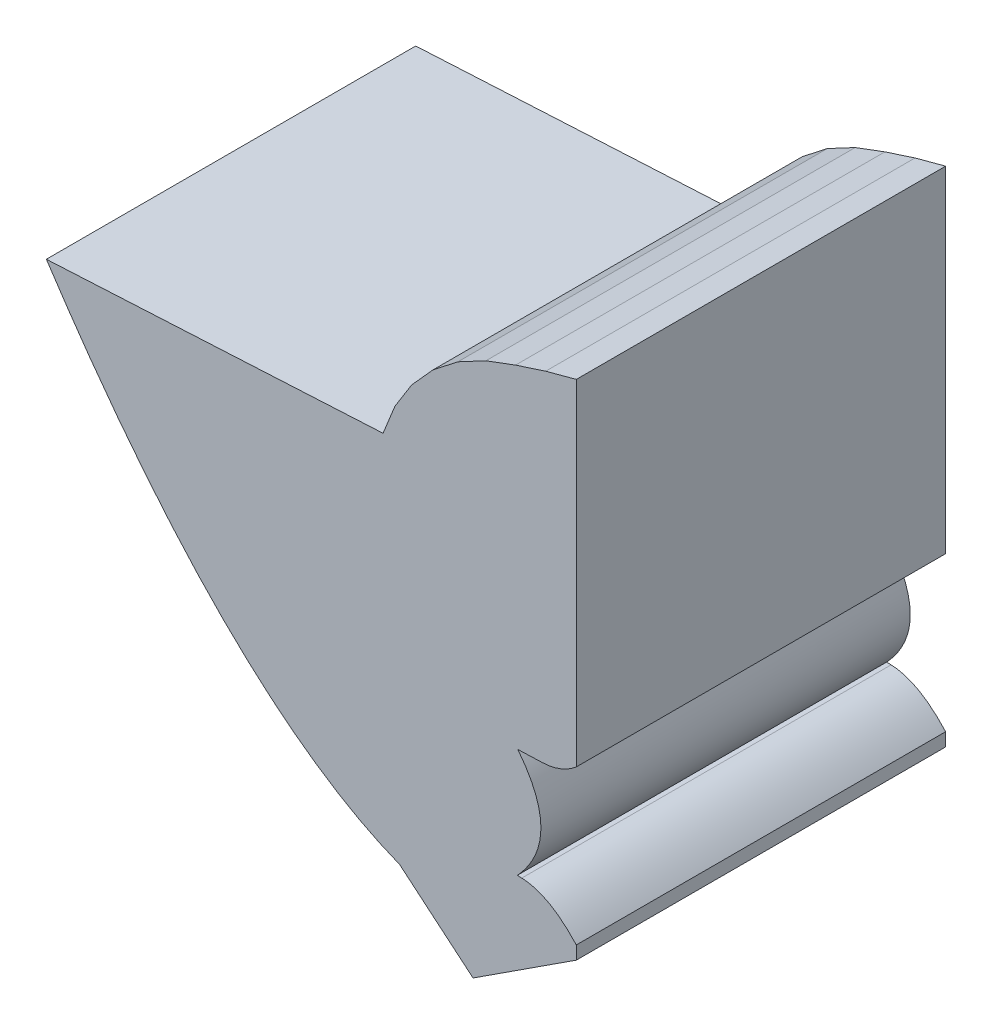
from build123d import *

# Parameters (mm, degrees)
CROQUIS_BASE_DEPTH              = 6.9937
LENTE_PPAL_1_REACH              = 29.176
LENTE_PPAL_1_DIRECTION_2_REACH  = 29.176
LENTE_PPAL_2_DEPTH              = 28.175928622
LENTE_PPAL_2_DEPTH_BACK         = 28.175928622
CROQUIS9_3_OUTSIDE_W            = 30.065
CROQUIS9_3_OUTSIDE_H            = 25.937
LENTE_FRONTAL_REACH             = 25.403
LENTE_FRONTAL_DIRECTION_2_REACH = 25.403
LENTE_TRASERA_REACH             = 28.281
LENTE_TRASERA_DIRECTION_2_REACH = 28.281


with BuildPart() as part:
    # Croquis1 → croquis base (new, symmetric)
    with BuildSketch(Plane.XY):
        with BuildLine():
            Line((-6.994875026, 10.477389992), (-8.981845695, 12.608155172))
            Line((-8.981845695, 12.608155172), (-23.035921146, 11.871612288))
            Line((-23.035921146, 11.871612288), (-23.035921146, 11.54013782))
            ThreePointArc((-23.035921146, 11.54013782), (-20.949684518, 9.582335705), (-18.945192114, 7.540918896))
            add(Edge.make_bspline(
                [(-18.945192114, 7.540918896), (-10.215008384, -3.697644103), (-2.846604825, -5.059081104)],
                knots=[0.497667241, 0.497667241, 0.497667241, 0.49955428, 0.49955428, 0.49955428], degree=2))
            add(Edge.make_bspline(
                [(-2.846604825, -5.059081104), (-2.498165198, -4.87297933), (-2.177330417, -4.684462446)],
                knots=[0.498812075, 0.498812075, 0.498812075, 0.498911556, 0.498911556, 0.498911556], degree=2))
            Line((-2.177330418, -4.684462446), (-2.177330418, 6.186438919))
            add(Edge.make_bspline(
                [(-2.177330418, 6.186438919), (-4.063319702, 8.141636997), (-6.994875026, 10.477389992)],
                knots=[0.50138293, 0.50138293, 0.50138293, 0.502013312, 0.502013312, 0.502013312], degree=2))
        make_face()
    extrude(amount=CROQUIS_BASE_DEPTH, both=True)

    # lente ppal 1: up to this face of the body (flat: up to its plane)
    lente_ppal_1_end = Plane(part.part.faces().sort_by_distance((-10.153546236, 5.159655324, 6.9937))[0])
    # Croquis9 → lente ppal 1 (add, up to the picked face)
    with BuildSketch(Plane.XY, mode=Mode.PRIVATE) as lente_ppal_1_sk1:
        with BuildLine():
            Line((-2.177330418, -4.388282022), (-2.177330418, -1.840420572))
            add(Edge.make_bspline(
                [(-2.177330418, 2.424232079), (-0.304369248, 0.128042884), (-2.177330418, -1.840420572)],
                knots=[0, 0, 0, 1, 1, 1], degree=2))
            Line((-2.177330418, 2.424232079), (-2.177330418, 6.082860828))
            Line((-2.177330418, 6.082860828), (-10.309820395, 10))
            Line((-10.309820395, 10), (-19.969359014, 9.493765032))
            add(Edge.make_bspline(
                [(-2.177330418, -4.388282022), (-10.4130765, -4.994158739), (-19.969359014, 9.493765032)],
                knots=[0, 0, 0, 1, 1, 1], degree=2))
        make_face()
    lente_ppal_1_tool1 = split(extrude(lente_ppal_1_sk1.sketch, amount=LENTE_PPAL_1_REACH, mode=Mode.PRIVATE), bisect_by=lente_ppal_1_end, keep=Keep.BOTH, mode=Mode.PRIVATE)
    add(lente_ppal_1_tool1.solids().sort_by(Axis((-9.106368, 3.599172, 0), (0, 0, 1)))[0])

    # lente ppal 1 direction 2: up to this face of the body (flat: up to its plane)
    lente_ppal_1_direction_2_end = Plane(part.part.faces().sort_by_distance((-10.153546236, 5.159655324, -6.9937))[0])
    # Croquis9 → lente ppal 1 direction 2 (add, up to the picked face)
    with BuildSketch(Plane.XY, mode=Mode.PRIVATE) as lente_ppal_1_direction_2_sk1:
        with BuildLine():
            Line((-2.177330418, -4.388282022), (-2.177330418, -1.840420572))
            add(Edge.make_bspline(
                [(-2.177330418, 2.424232079), (-0.304369248, 0.128042884), (-2.177330418, -1.840420572)],
                knots=[0, 0, 0, 1, 1, 1], degree=2))
            Line((-2.177330418, 2.424232079), (-2.177330418, 6.082860828))
            Line((-2.177330418, 6.082860828), (-10.309820395, 10))
            Line((-10.309820395, 10), (-19.969359014, 9.493765032))
            add(Edge.make_bspline(
                [(-2.177330418, -4.388282022), (-10.4130765, -4.994158739), (-19.969359014, 9.493765032)],
                knots=[0, 0, 0, 1, 1, 1], degree=2))
        make_face()
    lente_ppal_1_direction_2_tool1 = split(extrude(lente_ppal_1_direction_2_sk1.sketch, amount=-LENTE_PPAL_1_DIRECTION_2_REACH, mode=Mode.PRIVATE), bisect_by=lente_ppal_1_direction_2_end, keep=Keep.BOTH, mode=Mode.PRIVATE)
    add(lente_ppal_1_direction_2_tool1.solids().sort_by(Axis((-9.106368, 3.599172, 0), (0, 0, -1)))[0])

    # Croquis9<3> outside → lente ppal 2 (cut, two sides: drawn at the far end of the back side and taken through both)
    with BuildSketch(Plane.XY.offset(-LENTE_PPAL_2_DEPTH_BACK)):
        with Locations((-12.1385, 3.7745)):
            Rectangle(CROQUIS9_3_OUTSIDE_W, CROQUIS9_3_OUTSIDE_H)
        with BuildLine():
            Line((-2.177330418, -1.840420572), (-2.177330418, -4.388282022))
            add(Edge.make_bspline(
                [(-2.177330418, -4.388282022), (-10.4130765, -4.994158739), (-19.969359014, 9.493765032)],
                knots=[0, 0, 0, 1, 1, 1], degree=2))
            Line((-19.969359014, 9.493765032), (-10.309820395, 10))
            Line((-10.309820395, 10), (-2.177330418, 6.082860828))
            Line((-2.177330418, 6.082860828), (-2.177330418, 2.424232079))
            add(Edge.make_bspline(
                [(-2.177330418, 2.424232079), (-0.304369248, 0.128042884), (-2.177330418, -1.840420572)],
                knots=[0, 0, 0, 1, 1, 1], degree=2))
        make_face(mode=Mode.SUBTRACT)
    extrude(amount=LENTE_PPAL_2_DEPTH + LENTE_PPAL_2_DEPTH_BACK, mode=Mode.SUBTRACT)

    # lente frontal: up to this face of the body (flat: up to its plane)
    lente_frontal_end = Plane(part.part.faces().sort_by_distance((-9.106367081, 3.599171888, 6.9937))[0])
    # Croquis8 → lente frontal (add, up to the picked face)
    with BuildSketch(Plane.XY, mode=Mode.PRIVATE) as lente_frontal_sk1:
        with BuildLine():
            Line((0.1, 2.877673418), (0.1, 15.587903347))
            Line((0.1, 15.587903347), (-1.059110992, 15.277320493))
            Line((-1.059110992, 15.277320493), (-2.200378811, 14.9065001))
            Line((-2.200378811, 14.9065001), (-3.324385438, 14.486251242))
            Line((-3.324385438, 14.486251242), (-4.38392255, 13.922885367))
            Line((-4.38392255, 13.922885367), (-5.329535454, 13.184091597))
            Line((-5.329535454, 13.184091597), (-6.132492182, 12.292317806))
            Line((-6.132492182, 12.292317806), (-6.768395299, 11.274660091))
            Line((-6.768395299, 11.274660091), (-7.217923211, 10.162039465))
            Line((-7.217923211, 10.162039465), (-10.309820395, 10))
            Line((-10.309820395, 10), (-2.177330418, 2.342487007))
            Line((-2.177330418, 2.342487007), (-1.190501641, 2.376947827))
            add(Edge.make_bspline(
                [(-1.190501641, 2.376947827), (-0.463368169, 2.402339888), (0.1, 2.877673418)],
                knots=[0, 0, 0, 1, 1, 1], degree=2))
        make_face()
    lente_frontal_tool1 = split(extrude(lente_frontal_sk1.sketch, amount=LENTE_FRONTAL_REACH, mode=Mode.PRIVATE), bisect_by=lente_frontal_end, keep=Keep.BOTH, mode=Mode.PRIVATE)
    add(lente_frontal_tool1.solids().sort_by(Axis((-3.290182, 8.96302, 0), (0, 0, 1)))[0])

    # lente frontal direction 2: up to this face of the body (flat: up to its plane)
    lente_frontal_direction_2_end = Plane(part.part.faces().sort_by_distance((-9.106367081, 3.599171888, -6.9937))[0])
    # Croquis8 → lente frontal direction 2 (add, up to the picked face)
    with BuildSketch(Plane.XY, mode=Mode.PRIVATE) as lente_frontal_direction_2_sk1:
        with BuildLine():
            Line((0.1, 2.877673418), (0.1, 15.587903347))
            Line((0.1, 15.587903347), (-1.059110992, 15.277320493))
            Line((-1.059110992, 15.277320493), (-2.200378811, 14.9065001))
            Line((-2.200378811, 14.9065001), (-3.324385438, 14.486251242))
            Line((-3.324385438, 14.486251242), (-4.38392255, 13.922885367))
            Line((-4.38392255, 13.922885367), (-5.329535454, 13.184091597))
            Line((-5.329535454, 13.184091597), (-6.132492182, 12.292317806))
            Line((-6.132492182, 12.292317806), (-6.768395299, 11.274660091))
            Line((-6.768395299, 11.274660091), (-7.217923211, 10.162039465))
            Line((-7.217923211, 10.162039465), (-10.309820395, 10))
            Line((-10.309820395, 10), (-2.177330418, 2.342487007))
            Line((-2.177330418, 2.342487007), (-1.190501641, 2.376947827))
            add(Edge.make_bspline(
                [(-1.190501641, 2.376947827), (-0.463368169, 2.402339888), (0.1, 2.877673418)],
                knots=[0, 0, 0, 1, 1, 1], degree=2))
        make_face()
    lente_frontal_direction_2_tool1 = split(extrude(lente_frontal_direction_2_sk1.sketch, amount=-LENTE_FRONTAL_DIRECTION_2_REACH, mode=Mode.PRIVATE), bisect_by=lente_frontal_direction_2_end, keep=Keep.BOTH, mode=Mode.PRIVATE)
    add(lente_frontal_direction_2_tool1.solids().sort_by(Axis((-3.290182, 8.96302, 0), (0, 0, -1)))[0])

    # lente trasera: up to this face of the body (flat: up to its plane)
    lente_trasera_end = Plane(part.part.faces().sort_by_distance((-7.357064552, 5.305385386, 6.9937))[0])
    # Croquis11 → lente trasera (add, up to the picked face)
    with BuildSketch(Plane.XY, mode=Mode.PRIVATE) as lente_trasera_sk1:
        with BuildLine():
            Line((0.1, -2.960353775), (0.1, -3.460353775))
            Line((0.1, -3.460353775), (-3.810712242, -6))
            Line((-3.810712242, -6), (-9.112438619, -1.551323352))
            Line((-9.112438619, -1.551323352), (-1.965100505, -1.800913899))
            add(Edge.make_bspline(
                [(-1.965100505, -1.800913899), (-0.923066369, -1.837302533), (0.1, -2.960353775)],
                knots=[0, 0, 0, 1, 1, 1], degree=2))
        make_face()
    lente_trasera_tool1 = split(extrude(lente_trasera_sk1.sketch, amount=LENTE_TRASERA_REACH, mode=Mode.PRIVATE), bisect_by=lente_trasera_end, keep=Keep.BOTH, mode=Mode.PRIVATE)
    add(lente_trasera_tool1.solids().sort_by(Axis((-3.971821, -3.263775, 0), (0, 0, 1)))[0])

    # lente trasera direction 2: up to this face of the body (flat: up to its plane)
    lente_trasera_direction_2_end = Plane(part.part.faces().sort_by_distance((-7.357064552, 5.305385386, -6.9937))[0])
    # Croquis11 → lente trasera direction 2 (add, up to the picked face)
    with BuildSketch(Plane.XY, mode=Mode.PRIVATE) as lente_trasera_direction_2_sk1:
        with BuildLine():
            Line((0.1, -2.960353775), (0.1, -3.460353775))
            Line((0.1, -3.460353775), (-3.810712242, -6))
            Line((-3.810712242, -6), (-9.112438619, -1.551323352))
            Line((-9.112438619, -1.551323352), (-1.965100505, -1.800913899))
            add(Edge.make_bspline(
                [(-1.965100505, -1.800913899), (-0.923066369, -1.837302533), (0.1, -2.960353775)],
                knots=[0, 0, 0, 1, 1, 1], degree=2))
        make_face()
    lente_trasera_direction_2_tool1 = split(extrude(lente_trasera_direction_2_sk1.sketch, amount=-LENTE_TRASERA_DIRECTION_2_REACH, mode=Mode.PRIVATE), bisect_by=lente_trasera_direction_2_end, keep=Keep.BOTH, mode=Mode.PRIVATE)
    add(lente_trasera_direction_2_tool1.solids().sort_by(Axis((-3.971821, -3.263775, 0), (0, 0, -1)))[0])


solid = part.part
